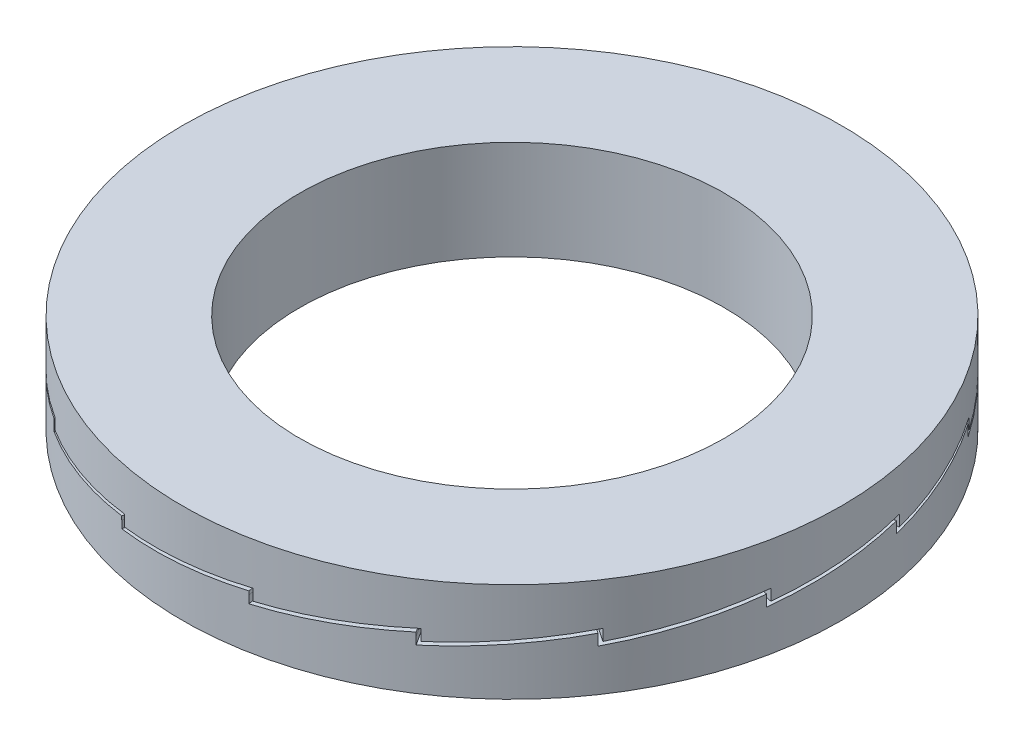
from build123d import *

# Parameters (mm, degrees)
SKETCH3_W                 = 2.95
SKETCH3_H                 = 2.5
PATTERN_CUT_PROFILE_COUNT = 16
PATTERN_CUT_PROFILE_ANGLE = 337.5


with BuildPart() as part:
    # Sketch3 → Base-Revolve (revolve)
    with BuildSketch(Plane.XY):
        with Locations((6.825, 0)):
            Rectangle(SKETCH3_W, SKETCH3_H)
    revolve(axis=Axis((0, -1.25, 0), (0, 1, 0)))

    # Sketch12 → Cut-Profile section 0
    with BuildSketch(Plane(origin=(7.632263469, 0, 0), x_dir=(0, 0, -1), z_dir=(1, 0, 0))):
        with BuildLine():
            Line((-1.601718458, -0.182075245), (1.434584732, 0.083566863))
            Line((1.434584732, 0.083566863), (1.434584732, 0))
            Line((1.434584732, 0), (1.518151595, 0))
            Line((1.518151595, 0), (1.518151595, 0.174764092))
            Line((1.518151595, 0.174764092), (-1.518151595, -0.090878017))
            Line((-1.518151595, -0.090878017), (-1.518151595, 0))
            Line((-1.518151595, 0), (-1.601718458, 0))
            Line((-1.601718458, 0), (-1.601718458, -0.182075245))
        make_face()
    # Sketch15 → Cut-Profile section 1
    with BuildSketch(Plane(origin=(8.3, 0, 0), x_dir=(0, 0, -1), z_dir=(1, 0, 0))):
        with BuildLine():
            Line((-1.745224991, 0), (-1.650972649, 0))
            Line((-1.650972649, 0), (-1.650972649, -0.102498353))
            Line((-1.650972649, -0.102498353), (1.650972649, 0.186384428))
            Line((1.650972649, 0.186384428), (1.650972649, 0))
            Line((1.650972649, 0), (1.556720308, 0))
            Line((1.556720308, 0), (1.556720308, 0.094252342))
            Line((1.556720308, 0.094252342), (-1.745224991, -0.19463044))
            Line((-1.745224991, -0.19463044), (-1.745224991, 0))
        make_face()
    cut_profile = loft(mode=Mode.SUBTRACT)

    # Pattern-Cut-Profile: Cut-Profile ×16 about axis
    pattern_cut_profile_axis = Axis((0, -1.25, 0), (0, 1, 0))
    for i in range(1, PATTERN_CUT_PROFILE_COUNT):
        add(cut_profile.rotate(pattern_cut_profile_axis, i * PATTERN_CUT_PROFILE_ANGLE / (PATTERN_CUT_PROFILE_COUNT - 1)), mode=Mode.SUBTRACT)


solid = part.part
